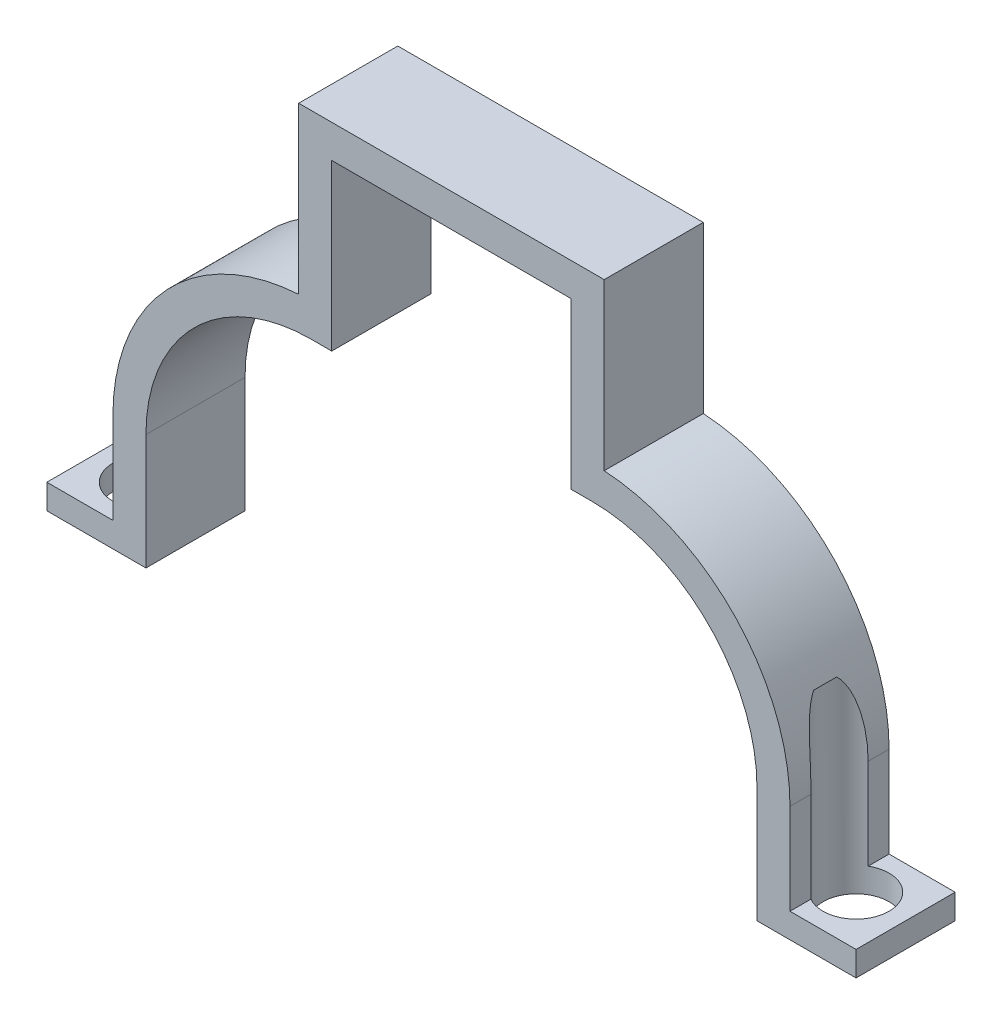
from build123d import *

# Parameters (mm, degrees)
EXTRUDE_1_DEPTH          = 6
CUT_EXTRUDE_1_DEPTH      = 10
CUT_EXTRUDE_1_DEPTH_BACK = 10
SKETCH_2_R               = 2


with BuildPart() as part:
    # 스케치1 → 보스-돌출1 (new body)
    with BuildSketch(Plane.XY):
        with BuildLine():
            Line((31.75, 18.5), (33, 18.5))
            ThreePointArc((33, 18.5), (40.071067812, 15.571067812), (43, 8.5))
            Line((43, 8.5), (43, 1.5))
            Line((43, 1.5), (49, 1.5))
            Line((49, 1.5), (49, 3))
            Line((49, 3), (45, 3))
            Line((45, 3), (45, 8.5))
            ThreePointArc((45, 8.5), (41.746427842, 16.715838363), (33.75, 20.476539567))
            Line((33.75, 20.476539567), (33.75, 30.5))
            Line((33.75, 30.5), (15.25, 30.5))
            Line((15.25, 30.5), (15.25, 20.476539567))
            ThreePointArc((15.25, 20.476539567), (7.253572158, 16.715838363), (4, 8.5))
            Line((4, 8.5), (4, 3))
            Line((4, 3), (0, 3))
            Line((0, 3), (0, 1.5))
            Line((0, 1.5), (6, 1.5))
            Line((6, 1.5), (6, 8.5))
            ThreePointArc((6, 8.5), (8.928932188, 15.571067812), (16, 18.5))
            Line((16, 18.5), (17.25, 18.5))
            Line((17.25, 18.5), (17.25, 28.5))
            Line((17.25, 28.5), (31.75, 28.5))
            Line((31.75, 28.5), (31.75, 18.5))
        make_face()
    extrude(amount=EXTRUDE_1_DEPTH)

    # 스케치2 → 컷-돌출1 (cut, two sides: drawn at the far end of the back side and taken through both)
    with BuildSketch(Plane(origin=(0, 3, 0), x_dir=(1, 0, 0), z_dir=(0, 1, 0)).offset(-CUT_EXTRUDE_1_DEPTH_BACK)):
        with BuildLine():
            ThreePointArc((45, -4.732050808), (47, -4.732050808), (48, -3))
            ThreePointArc((48, -3), (47, -1.267949192), (45, -1.267949192))
            Line((45, -1.267949192), (45, -4.732050808))
        make_face()
        with BuildLine():
            Line((45, -4.732050808), (45, -1.267949192))
            ThreePointArc((45, -1.267949192), (44, -3), (45, -4.732050808))
        make_face()
        with Locations(Location((3, -3, 0), (0, 0, 60))):
            Circle(SKETCH_2_R)
    extrude(amount=CUT_EXTRUDE_1_DEPTH + CUT_EXTRUDE_1_DEPTH_BACK, mode=Mode.SUBTRACT)


solid = part.part
